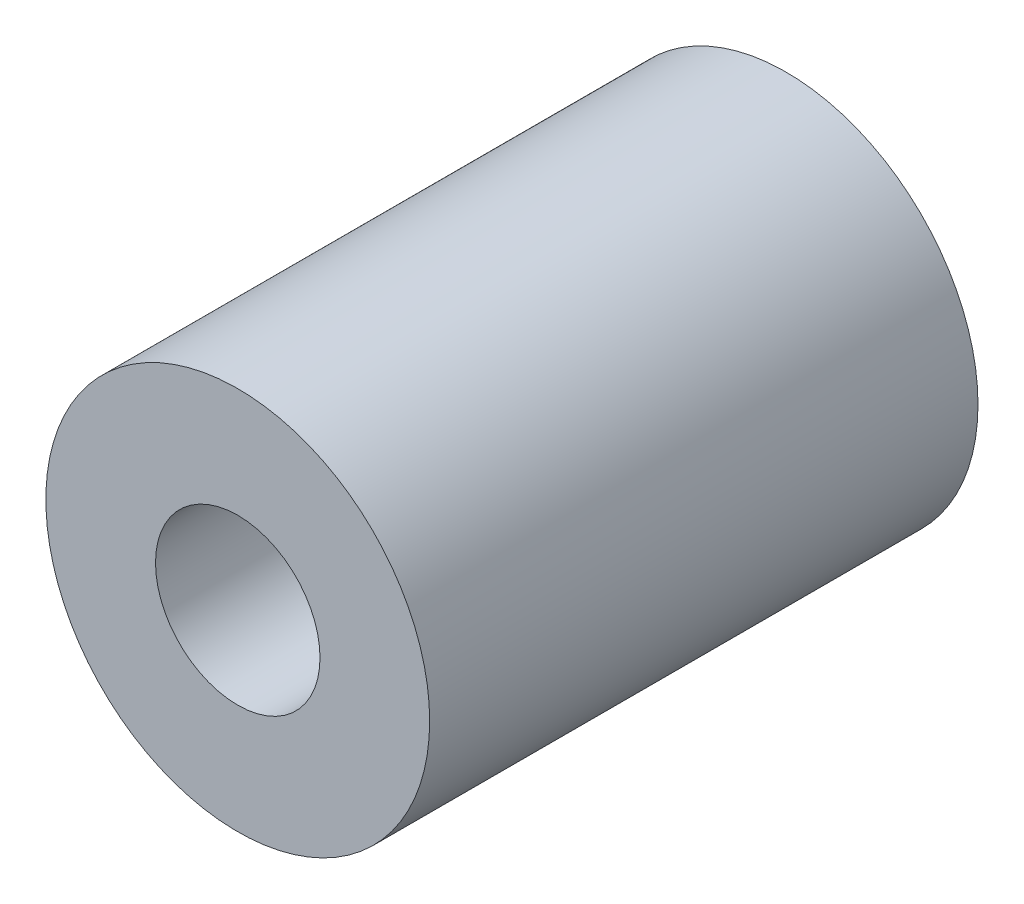
from build123d import *

# Parameters (mm, degrees)
SKETCH1_R           = 3.5
SKETCH1_R_2         = 1.5
BOSS_EXTRUDE1_DEPTH = 10


with BuildPart() as part:
    # Sketch1 → Boss-Extrude1 (new body)
    with BuildSketch(Plane.XY):
        with Locations((-0.677853788, 1.338100984)):
            Circle(SKETCH1_R)
        with Locations((-0.677853788, 1.338100984)):
            Circle(SKETCH1_R_2, mode=Mode.SUBTRACT)
    extrude(amount=BOSS_EXTRUDE1_DEPTH)


solid = part.part
